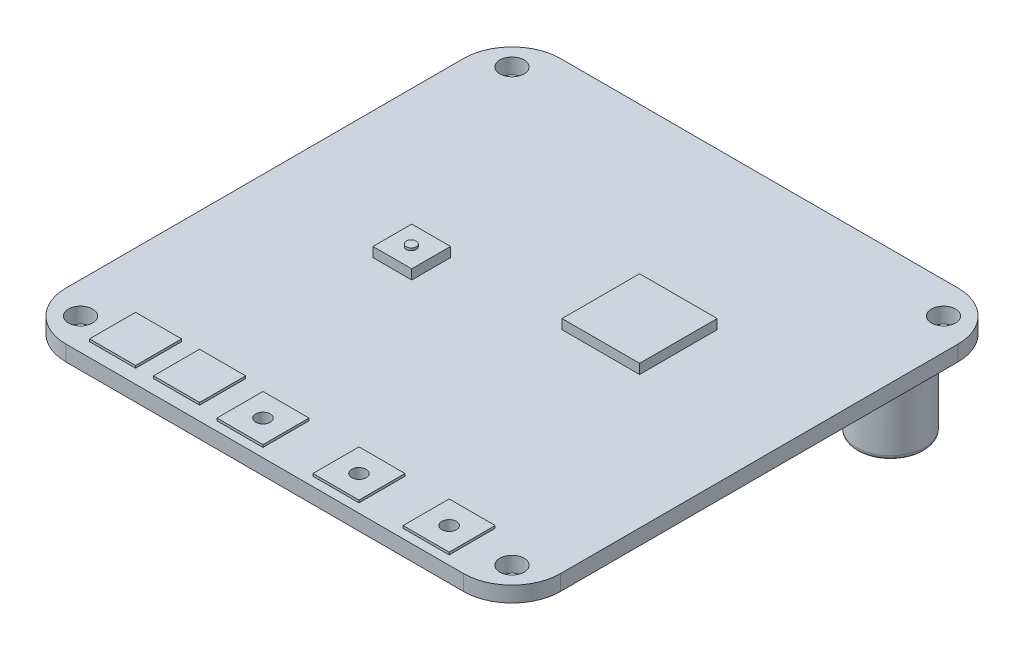
from build123d import *

# Parameters (mm, degrees)
CROQUIS1_W              = 51
CROQUIS1_H              = 51
SALIENTE_EXTRUIR1_DEPTH = 1.6
REDONDEO1_R             = 5
CROQUIS2_W              = 4
CROQUIS2_H              = 4
CROQUIS2_W_2            = 8
CROQUIS2_H_2            = 8
SALIENTE_EXTRUIR2_DEPTH = 1
CROQUIS3_R              = 1.25
CORTAR_EXTRUIR1_DEPTH   = 37.097922378
CROQUIS4_W              = 4.75
CROQUIS4_H              = 4.75
SALIENTE_EXTRUIR3_DEPTH = 0.25
CROQUIS5_R              = 0.75
CORTAR_EXTRUIR2_DEPTH   = 37.109867073
CROQUIS6_R              = 3.5
SALIENTE_EXTRUIR4_DEPTH = 12
REDONDEO2_R             = 0.5
CROQUIS7_W              = 38.1
CROQUIS7_H              = 2.54
SALIENTE_EXTRUIR5_DEPTH = 8
CROQUIS8_R              = 0.512123022
SALIENTE_EXTRUIR6_DEPTH = 0.25


with BuildPart() as part:
    # Croquis1 → Saliente-Extruir1 (new body)
    with BuildSketch(Plane(origin=(0, 0, 0), x_dir=(1, 0, 0), z_dir=(0, 1, 0))):
        Rectangle(CROQUIS1_W, CROQUIS1_H)
    extrude(amount=-SALIENTE_EXTRUIR1_DEPTH)

    # Redondeo1
    redondeo1_edges = [part.edges().sort_by_distance(p)[0] for p in [
        (25.5, -0.8, 25.5),
        (-25.5, -0.8, 25.5),
        (-25.5, -0.8, -25.5),
        (25.5, -0.8, -25.5),
    ]]
    fillet(redondeo1_edges, radius=REDONDEO1_R)

    # Croquis2 → Saliente-Extruir2 (add)
    with BuildSketch(Plane(origin=(0, 0, 0), x_dir=(1, 0, 0), z_dir=(0, 1, 0))):
        with Locations((-10.387074195, 0.047356258)):
            Rectangle(CROQUIS2_W, CROQUIS2_H)
        with Locations((7.8, 5.359014033)):
            Rectangle(CROQUIS2_W_2, CROQUIS2_H_2)
    extrude(amount=SALIENTE_EXTRUIR2_DEPTH)

    # Croquis3 → Cortar-Extruir1 (cut, through all)
    with BuildSketch(Plane(origin=(0, 0, 0), x_dir=(1, 0, 0), z_dir=(0, 1, 0))):
        with Locations(Location((-22.25, 22.25, 0), (0, 0, 270))):
            Circle(CROQUIS3_R)
        with Locations(Location((-22.25, -22.25, 0), (0, 0, 270))):
            Circle(CROQUIS3_R)
        with Locations(Location((22.25, -22.25, 0), (0, 0, 270))):
            Circle(CROQUIS3_R)
        with Locations(Location((22.25, 22.25, 0), (0, 0, 270))):
            Circle(CROQUIS3_R)
    extrude(amount=-CORTAR_EXTRUIR1_DEPTH, mode=Mode.SUBTRACT)

    # Croquis4 → Saliente-Extruir3 (add)
    with BuildSketch(Plane(origin=(0, 0, 0), x_dir=(1, 0, 0), z_dir=(0, 1, 0))):
        with Locations((-3.48, -22.2)):
            Rectangle(CROQUIS4_W, CROQUIS4_H)
        with Locations((6.42, -22.2)):
            Rectangle(CROQUIS4_W, CROQUIS4_H)
        with Locations((15.72, -22.2)):
            Rectangle(CROQUIS4_W, CROQUIS4_H)
        with Locations((-10.52, -21.7)):
            Rectangle(CROQUIS4_W, CROQUIS4_H)
        with Locations((-17.12, -21.7)):
            Rectangle(CROQUIS4_W, CROQUIS4_H)
    extrude(amount=SALIENTE_EXTRUIR3_DEPTH)

    # Croquis5 → Cortar-Extruir2 (cut, through all)
    with BuildSketch(Plane(origin=(0, 0.25, 0), x_dir=(1, 0, 0), z_dir=(0, 1, 0))):
        with Locations(Location((-3.48, -22.2, 0), (0, 0, 270))):
            Circle(CROQUIS5_R)
        with Locations(Location((6.42, -22.2, 0), (0, 0, 270))):
            Circle(CROQUIS5_R)
        with Locations(Location((15.72, -22.2, 0), (0, 0, 270))):
            Circle(CROQUIS5_R)
    extrude(amount=-CORTAR_EXTRUIR2_DEPTH, mode=Mode.SUBTRACT)

    # Croquis6 → Saliente-Extruir4 (add)
    with BuildSketch(Plane(origin=(0, -1.6, 0), x_dir=(1, 0, 0), z_dir=(0, 1, 0))):
        with Locations(Location((-16.236720917, 22.626792328, 0), (0, 0, 270))):
            Circle(CROQUIS6_R)
        with Locations(Location((16.410663599, 22.626792328, 0), (0, 0, 270))):
            Circle(CROQUIS6_R)
    extrude(amount=-SALIENTE_EXTRUIR4_DEPTH)

    # Redondeo2
    redondeo2_edges = [part.edges().sort_by_distance(p)[0] for p in [
        (-16.236720917, -13.6, -26.126792328),
        (16.410663599, -13.6, -26.126792328),
    ]]
    fillet(redondeo2_edges, radius=REDONDEO2_R)

    # Croquis7 → Saliente-Extruir5 (add)
    with BuildSketch(Plane.XZ.offset(1.6)):
        with Locations((-3.45, -17.29)):
            Rectangle(CROQUIS7_W, CROQUIS7_H)
        with Locations((-3.45, 8.06)):
            Rectangle(CROQUIS7_W, CROQUIS7_H)
    extrude(amount=SALIENTE_EXTRUIR5_DEPTH)

    # Croquis8 → Saliente-Extruir6 (add)
    with BuildSketch(Plane(origin=(0, 1, 0), x_dir=(1, 0, 0), z_dir=(0, 1, 0))):
        with Locations(Location((-10.387074195, 0, 0), (0, 0, 270))):
            Circle(CROQUIS8_R)
    extrude(amount=SALIENTE_EXTRUIR6_DEPTH)


solid = part.part
